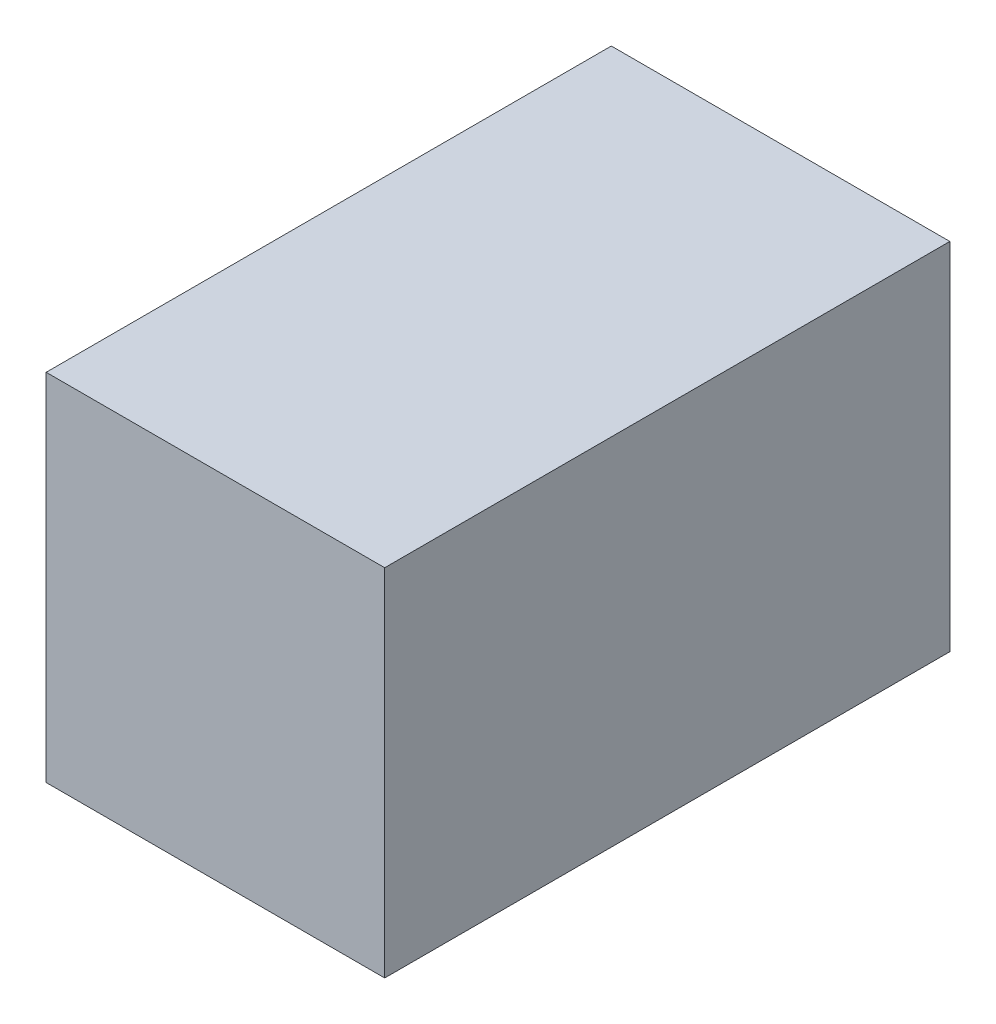
from build123d import *

# Parameters (mm, degrees)
SKETCH1_W           = 121
SKETCH1_H           = 202
BOSS_EXTRUDE1_DEPTH = 127


with BuildPart() as part:
    # Sketch1 → Boss-Extrude1 (new body)
    with BuildSketch(Plane(origin=(0, 0, 0), x_dir=(1, 0, 0), z_dir=(0, 1, 0))):
        Rectangle(SKETCH1_W, SKETCH1_H)
    extrude(amount=BOSS_EXTRUDE1_DEPTH)


solid = part.part
